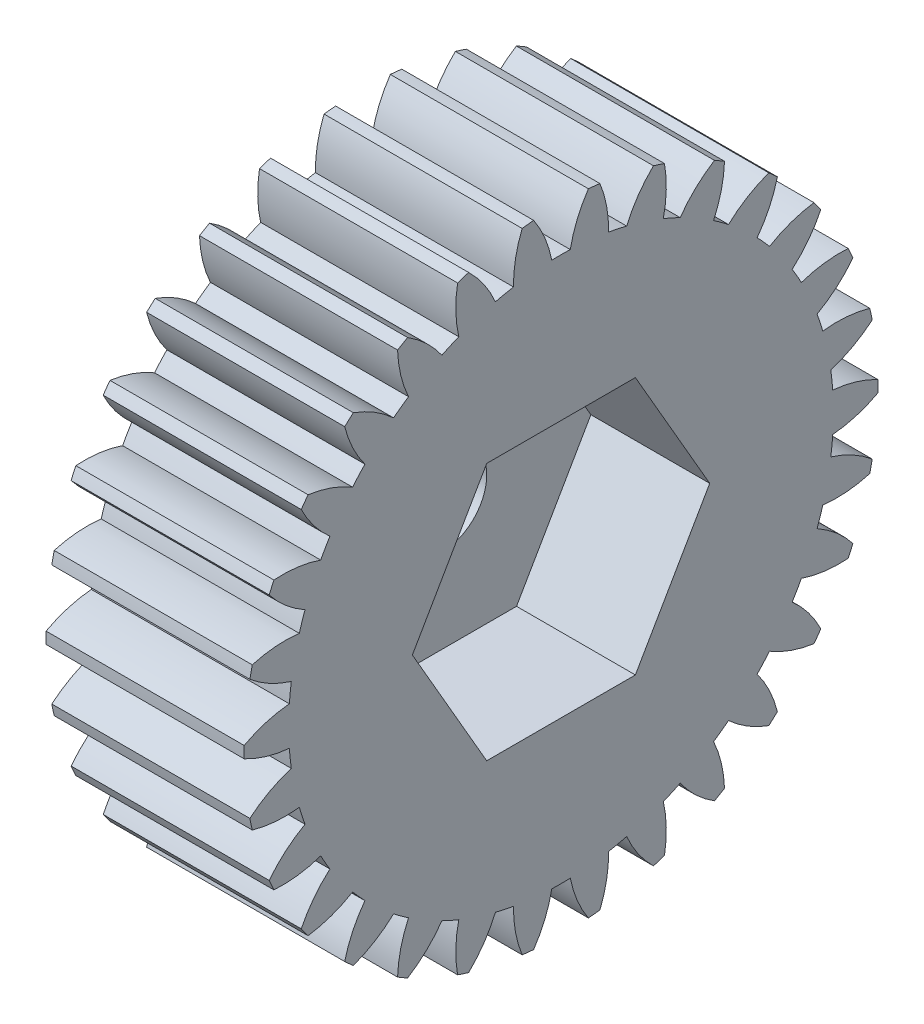
from build123d import *

# Parameters (mm, degrees)
BASPROSKE_W        = 10
BASPROSKE_H        = 16
TOOTHCUT_DEPTH     = 25.738633754
TEETHCUTS_COUNT    = 30
TEETHCUTS_ANGLE    = 348
BORSKE_R           = 0.4
BORE_DEPTH         = 50.0000508
CUT_EXTRUDE2_DEPTH = 6
SKETCH7_R          = 2.25
CUT_EXTRUDE3_DEPTH = 6


with BuildPart() as part:
    # BasProSke → Base-Revolve (revolve)
    with BuildSketch(Plane(origin=(0, 0, 0), x_dir=(1, 0, 0), z_dir=(0, 1, 0)), mode=Mode.PRIVATE) as base_revolve_sk:
        with Locations((5, 8)):
            Rectangle(BASPROSKE_W, BASPROSKE_H)
    revolve(base_revolve_sk.sketch.rotate(Axis((-10, 0, 0), (1, 0, 0)), 180), axis=Axis((-10, 0, 0), (1, 0, 0)))

    # TooCutSke → ToothCut (cut, through all)
    with BuildSketch(Plane(origin=(0, 0, 0), x_dir=(0, 0, -1), z_dir=(1, 0, 0))):
        with BuildLine():
            ThreePointArc((0.466400716, 13.741086979), (0, 13.749), (-0.466400716, 13.741086979))
            ThreePointArc((-0.466400716, 13.741086979), (-0.819142092, 14.899954875), (-1.3974676, 15.964351834))
            ThreePointArc((-1.3974676, 15.964351834), (0, 16.0254), (1.3974676, 15.964351834))
            ThreePointArc((1.3974676, 15.964351834), (0.819142092, 14.899954875), (0.466400716, 13.741086979))
        make_face()
    toothcut = extrude(amount=TOOTHCUT_DEPTH, mode=Mode.SUBTRACT)

    # TeethCuts: ToothCut ×30 about axis
    teethcuts_axis = Axis((-10, 0, 0), (1, 0, 0))
    for i in range(1, TEETHCUTS_COUNT):
        add(toothcut.rotate(teethcuts_axis, i * TEETHCUTS_ANGLE / (TEETHCUTS_COUNT - 1)), mode=Mode.SUBTRACT)

    # BorSke → Bore (cut, symmetric)
    with BuildSketch(Plane(origin=(0, 0, 0), x_dir=(0, 0, -1), z_dir=(1, 0, 0))):
        with Locations(Location((0, 0, 0), (0, 0, 180))):
            Circle(BORSKE_R)
    extrude(amount=BORE_DEPTH, both=True, mode=Mode.SUBTRACT)

    # Sketch6 → Cut-Extrude2 (cut)
    with BuildSketch(Plane(origin=(10, 0, 0), x_dir=(0, 0, -1), z_dir=(1, 0, 0))):
        Polygon((-3.75277675, 6.5), (3.75277675, 6.5), (7.505553499, 0), (3.75277675, -6.5), (-3.75277675, -6.5), (-7.505553499, 0), align=None)
    extrude(amount=-CUT_EXTRUDE2_DEPTH, mode=Mode.SUBTRACT)

    # Sketch7 → Cut-Extrude3 (cut)
    with BuildSketch(Plane.ZY):
        Circle(SKETCH7_R)
    extrude(amount=-CUT_EXTRUDE3_DEPTH, mode=Mode.SUBTRACT)


solid = part.part
